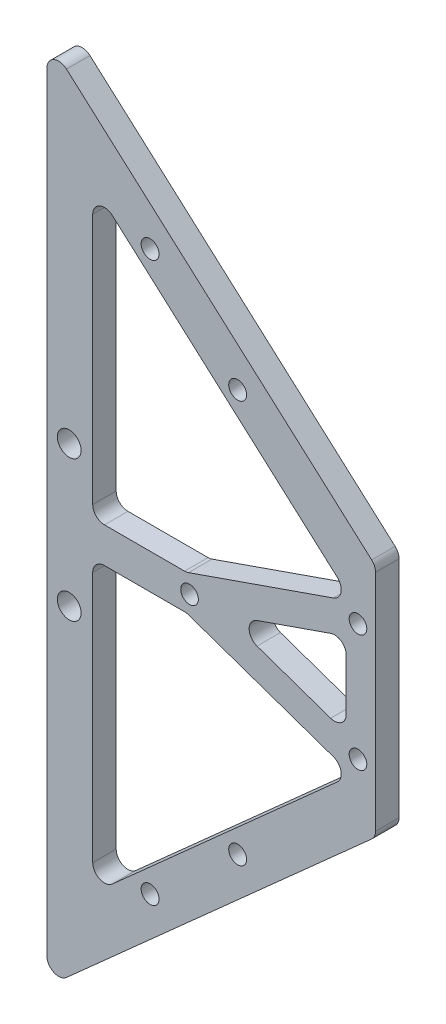
from build123d import *

# Parameters (mm, degrees)
SKETCH_1_W          = 56
SKETCH_1_H          = 40
EXTRUDE_1_DEPTH     = 4
SKETCH_2_R          = 1.5
SKETCH_2_R_2        = 2.025
SKETCH_2_R_3        = 1.025
CUT_EXTRUDE_1_DEPTH = 34
EXTRUDE_2_DEPTH     = 4
SKETCH_4_R          = 1.525
CUT_EXTRUDE_2_DEPTH = 10
FILLET_1_R          = 2
CUT_EXTRUDE_3_DEPTH = 22
FILLET_2_R          = 2


with BuildPart() as part:
    # 草图1 → 凸台-拉伸1 (new body)
    with BuildSketch(Plane.XY):
        Rectangle(SKETCH_1_W, SKETCH_1_H)
    extrude(amount=EXTRUDE_1_DEPTH)

    # 草图2 → 切除-拉伸1 (cut)
    with BuildSketch(Plane(origin=(0, 0, 0), x_dir=(-1, 0, 0), z_dir=(0, 0, -1))):
        with Locations((3.7, 0)):
            Circle(SKETCH_2_R)
        with Locations((-25, 10)):
            Circle(SKETCH_2_R)
        with Locations((-25, -10)):
            Circle(SKETCH_2_R)
        with Locations((24.2, -12)):
            Circle(SKETCH_2_R_2)
        with Locations((24.2, 12)):
            Circle(SKETCH_2_R_2)
        with Locations((7.7, -9)):
            Circle(SKETCH_2_R_3)
        with Locations((15.7, -9)):
            Circle(SKETCH_2_R_3)
    extrude(amount=-CUT_EXTRUDE_1_DEPTH, mode=Mode.SUBTRACT)

    # 草图3 → 凸台-拉伸2 (add)
    with BuildSketch(Plane.XY.offset(4)):
        Polygon((28, 20), (-28, 70), (-28, 20), align=None)
    extrude_2 = extrude(amount=-EXTRUDE_2_DEPTH)

    # 镜向1: 凸台-拉伸2 across plane
    add(extrude_2.mirror(Plane.ZX))

    # 草图4 → 切除-拉伸2 (cut)
    with BuildSketch(Plane(origin=(0, 0, 0), x_dir=(-1, 0, 0), z_dir=(0, 0, -1))):
        with Locations((10.420660221, -47.601187919)):
            Circle(SKETCH_4_R)
        with Locations((-4.498093012, -34.280872533)):
            Circle(SKETCH_4_R)
    cut_extrude_2 = extrude(amount=-CUT_EXTRUDE_2_DEPTH, mode=Mode.SUBTRACT)

    # 镜向2: 切除-拉伸2 across plane
    add(cut_extrude_2.mirror(Plane.ZX), mode=Mode.SUBTRACT)

    # 圆角1
    fillet_1_edges = [part.edges().sort_by_distance(p)[0] for p in [
        (-28, 70, 2),
        (-28, -70, 2),
        (28, -20, 2),
        (28, 20, 2),
    ]]
    fillet(fillet_1_edges, radius=FILLET_1_R)

    # 草图5 → 切除-拉伸3 (cut)
    with BuildSketch(Plane(origin=(0, 0, 0), x_dir=(-1, 0, 0), z_dir=(0, 0, -1))):
        Polygon((-23, 7.185207752), (-2.378453751, 0), (-23, -7.185207752), align=None)
        Polygon((20.2, 52.310957498), (-24.014671549, 12.833572186), (4.207680626, 3), (20.2, 3), align=None)
        Polygon((4.207680626, -3), (20.2, -3), (20.2, -52.310957498), (-24.014671549, -12.833572186), align=None)
    extrude(amount=-CUT_EXTRUDE_3_DEPTH, mode=Mode.SUBTRACT)

    # 圆角2
    fillet_2_edges = [part.edges().sort_by_distance(p)[0] for p in [
        (24.014671549, -12.833572186, 2),
        (-4.207680626, -3, 2),
        (-20.2, -3, 2),
        (-20.2, -52.310957498, 2),
        (-20.2, 52.310957498, 2),
        (-20.2, 3, 2),
        (-4.207680626, 3, 2),
        (24.014671549, 12.833572186, 2),
        (23, -7.185207752, 2),
        (23, 7.185207752, 2),
        (2.378453751, 0, 2),
    ]]
    fillet(fillet_2_edges, radius=FILLET_2_R)


solid = part.part
